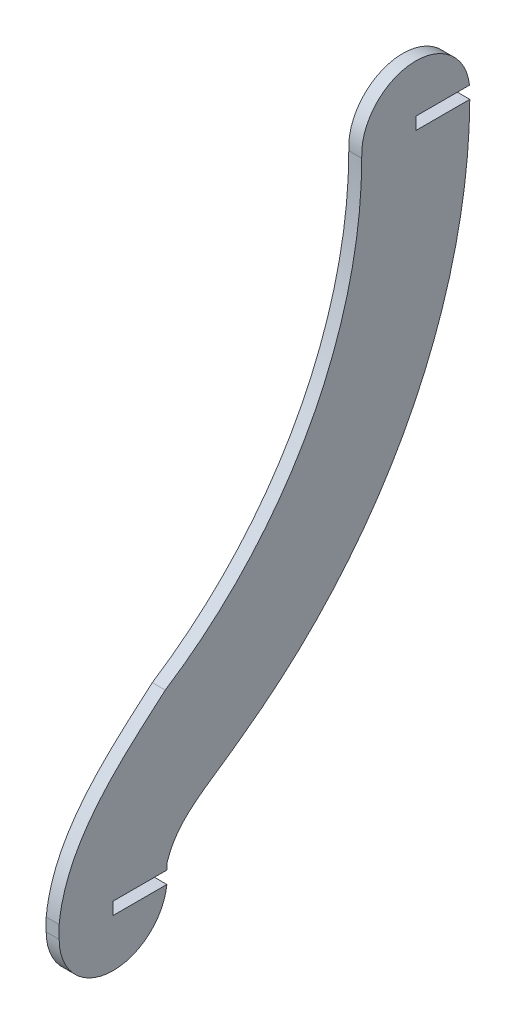
from build123d import *

# Parameters (mm, degrees)
BOSS_EXTRUDE2_DEPTH = 3
SKETCH2_W           = 12.5
SKETCH2_H           = 2.87
CUT_EXTRUDE1_DEPTH  = 3


with BuildPart() as part:
    # Sketch1 → Boss-Extrude2 (new body)
    with BuildSketch(Plane(origin=(0, 0, 0), x_dir=(0, 0, -1), z_dir=(1, 0, 0))):
        with BuildLine():
            Line((125, 0), (125, 1.5))
            ThreePointArc((125, 1.5), (111.75, 13.25), (100, 0))
            ThreePointArc((100, 0), (87.904372108, -47.674116292), (54.543572715, -83.81526517))
            add(Edge.make_bspline(
                [(54.543572715, -83.81526517), (44.434436781, -92.608940988), (31.581333534, -102.945692353), (30, -118.5)],
                knots=[0, 0, 0, 0, 1, 1, 1, 1], degree=3))
            Line((30, -118.5), (30, -121.5))
            ThreePointArc((30, -121.5), (42.5, -134), (55, -121.5))
            Line((55, -121.5), (55, -118.5))
            add(Edge.make_bspline(
                [(55, -118.5), (57.384287812, -110.868607185), (64.548856078, -107.860641761), (72.347282186, -101.935620665)],
                knots=[0, 0, 0, 0, 1, 1, 1, 1], degree=3))
            ThreePointArc((72.347282186, -101.935620665), (111.059466668, -57.365450084), (125, 0))
        make_face()
    extrude(amount=BOSS_EXTRUDE2_DEPTH)

    # Sketch2 → Cut-Extrude1 (cut)
    with BuildSketch(Plane(origin=(3, 0, 0), x_dir=(0, 0, -1), z_dir=(1, 0, 0))):
        with Locations((118.75, 0.75)):
            Rectangle(SKETCH2_W, SKETCH2_H)
        with Locations((48.75, -121.5)):
            Rectangle(SKETCH2_W, SKETCH2_H)
    extrude(amount=-CUT_EXTRUDE1_DEPTH, mode=Mode.SUBTRACT)


solid = part.part
